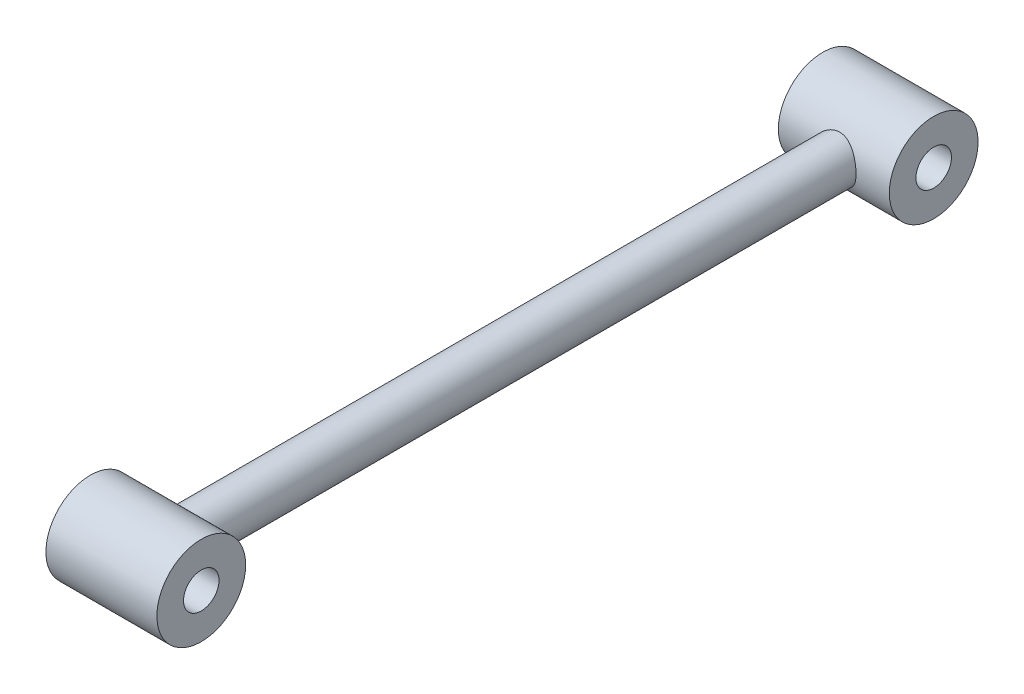
from build123d import *

# Parameters (mm, degrees)
SKETCH1_R                = 5
BOSS_EXTRUDE1_DEPTH      = 165
BOSS_EXTRUDE2_DEPTH      = 12.5
BOSS_EXTRUDE2_DEPTH_BACK = 12.5
SKETCH2_R                = 10
SKETCH2_R_2              = 4
CUT_EXTRUDE1_DEPTH       = 176.73061782
CUT_EXTRUDE1_DEPTH_BACK  = 176.73061782
SKETCH2_2_R              = 4


with BuildPart() as part:
    # Sketch1 → Boss-Extrude1 (new body)
    with BuildSketch(Plane.XY):
        Circle(SKETCH1_R)
    extrude(amount=BOSS_EXTRUDE1_DEPTH)

    # Sketch2 → Boss-Extrude2 (add, two sides: drawn at the far end of the back side and taken through both)
    # profile 1 of 2: a face of its own
    with BuildSketch(Plane(origin=(0, 0, 0), x_dir=(0, 0, -1), z_dir=(1, 0, 0)).offset(-BOSS_EXTRUDE2_DEPTH_BACK)):
        with Locations((-165, 0)):
            Circle(SKETCH2_R)
        with Locations((-165, 0)):
            Circle(SKETCH2_R_2, mode=Mode.SUBTRACT)
    # profile 2 of 2: a face of its own
    with BuildSketch(Plane(origin=(0, 0, 0), x_dir=(0, 0, -1), z_dir=(1, 0, 0)).offset(-BOSS_EXTRUDE2_DEPTH_BACK)):
        Circle(SKETCH2_R)
        Circle(SKETCH2_R_2, mode=Mode.SUBTRACT)
    extrude(amount=BOSS_EXTRUDE2_DEPTH + BOSS_EXTRUDE2_DEPTH_BACK)

    # Sketch2<2> → Cut-Extrude1 (cut, two sides: drawn at the far end of the back side and taken through both)
    with BuildSketch(Plane(origin=(0, 0, 0), x_dir=(0, 0, -1), z_dir=(1, 0, 0)).offset(-CUT_EXTRUDE1_DEPTH_BACK)):
        with Locations((-165, 0)):
            Circle(SKETCH2_2_R)
        Circle(SKETCH2_2_R)
    extrude(amount=CUT_EXTRUDE1_DEPTH + CUT_EXTRUDE1_DEPTH_BACK, mode=Mode.SUBTRACT)


solid = part.part
